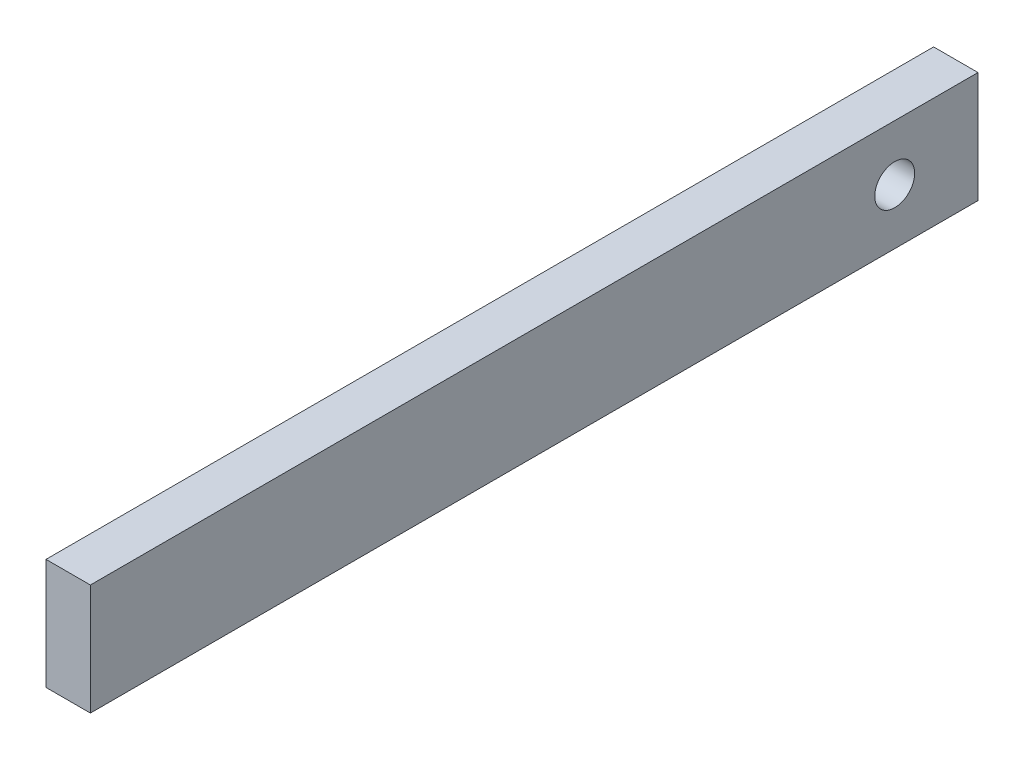
from build123d import *

# Parameters (mm, degrees)
SKETCH1_W           = 400
SKETCH1_H           = 50
SKETCH1_R           = 9
BOSS_EXTRUDE1_DEPTH = 20


with BuildPart() as part:
    # Sketch1 → Boss-Extrude1 (new body)
    with BuildSketch(Plane(origin=(0, 0, 0), x_dir=(0, 0, -1), z_dir=(1, 0, 0))):
        with Locations((28.374697864, 26.026392962)):
            Rectangle(SKETCH1_W, SKETCH1_H)
        with Locations((190.838040972, 26.026392962)):
            Circle(SKETCH1_R, mode=Mode.SUBTRACT)
    extrude(amount=BOSS_EXTRUDE1_DEPTH)


solid = part.part
